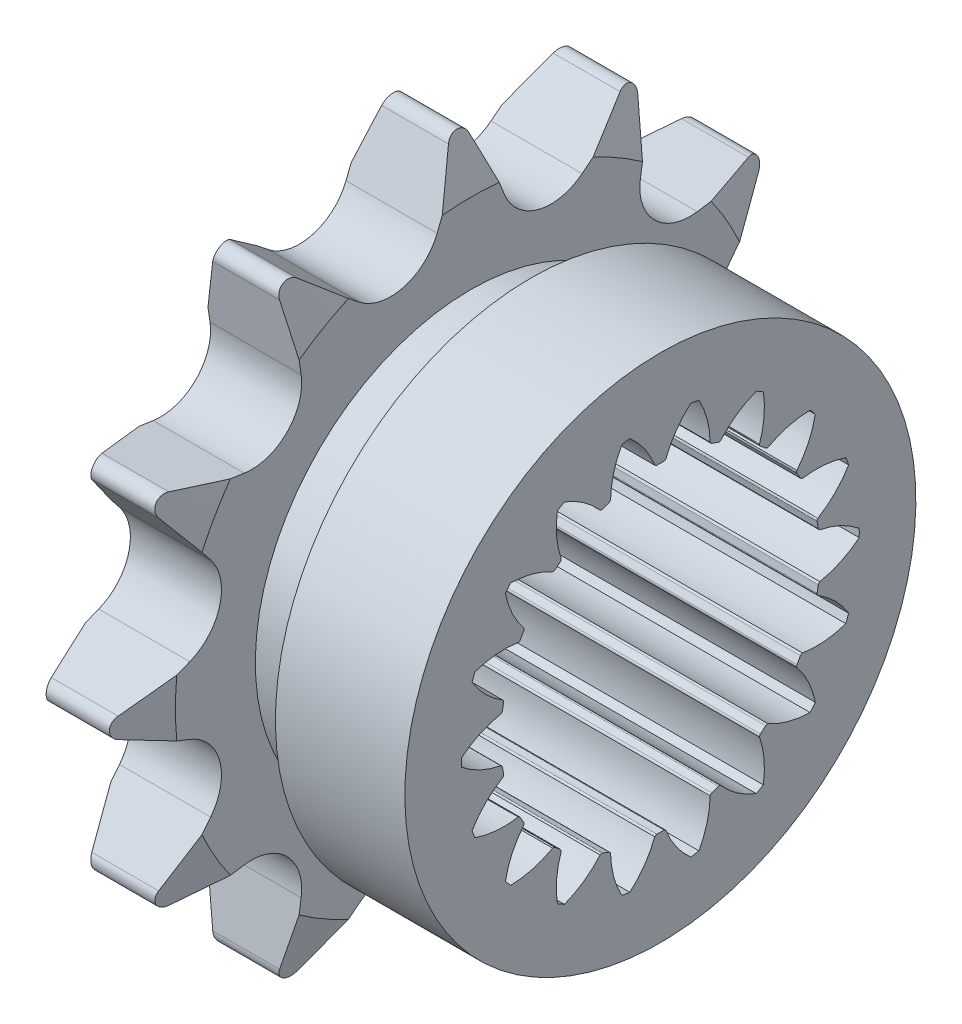
from build123d import *

# Parameters (mm, degrees)
SKETCH13_W         = 22.225
SKETCH13_H         = 27.5082
CUT_EXTRUDE1_DEPTH = 7.2136
CIRPATTERN1_COUNT  = 12
SKETCH15_W         = 127
SKETCH15_H         = 22.5171
SKETCH16_W         = 4.7625
SKETCH16_H         = 3.175
CUT_EXTRUDE2_DEPTH = 45.803490606


with BuildPart() as part:
    # Sketch13 → Revolve1 (revolve)
    with BuildSketch(Plane.XY):
        with Locations((11.1125, 13.7541)):
            Rectangle(SKETCH13_W, SKETCH13_H)
    revolve(axis=Axis((0, 0, 0), (-1, 0, 0)))

    # Sketch6 → Cut-Extrude1 (cut)
    with BuildSketch(Plane(origin=(0, -16.51, 0), x_dir=(0, 0, -1), z_dir=(1, 0, 0))):
        with BuildLine():
            Line((-0.805715716, 43.469749783), (-2.663822441, 38.756002806))
            ThreePointArc((-2.663822441, 38.756002806), (-5.324614334, 36.381731224), (-8.816063498, 37.107514783))
            Line((-8.816063498, 37.107514783), (-12.782104613, 40.260686049))
            ThreePointArc((-12.782104613, 40.260686049), (-13.256994885, 40.44645554), (-13.7541, 40.332800012))
            ThreePointArc((-13.7541, 40.332800012), (-7.119646056, 43.080880815), (0, 44.0182))
            ThreePointArc((0, 44.0182), (-0.487333422, 43.868076017), (-0.805715716, 43.469749783))
        make_face()
    cut_extrude1 = extrude(amount=CUT_EXTRUDE1_DEPTH, mode=Mode.SUBTRACT)

    # CirPattern1: Cut-Extrude1 ×12 about axis
    cirpattern1_axis = Axis((-63.015770793, 0, 0), (1, 0, 0))
    for i in range(1, CIRPATTERN1_COUNT):
        add(cut_extrude1.rotate(cirpattern1_axis, i * 360 / CIRPATTERN1_COUNT), mode=Mode.SUBTRACT)

    # Sketch15 → hub Cut-Revolve3 (revolve, cut)
    with BuildSketch(Plane.XY):
        with Locations((70.7136, 31.48965)):
            Rectangle(SKETCH15_W, SKETCH15_H)
        with Locations((-63.5, 31.48965)):
            Rectangle(SKETCH15_W, SKETCH15_H)
    revolve(axis=Axis((0, 0, 0), (-1, 0, 0)), mode=Mode.SUBTRACT)

    # Sketch4 → Teeth Chamfer (revolve, cut)
    with BuildSketch(Plane.XY):
        Polygon((0, 27.5082), (1.104501883, 27.5082), (0, 23.386142857), align=None)
        Polygon((7.2136, 27.5082), (6.109098117, 27.5082), (7.2136, 23.386142857), align=None)
    revolve(axis=Axis((0, 0, 0), (-1, 0, 0)), mode=Mode.SUBTRACT)

    # Sketch16 → Recess (revolve, cut)
    with BuildSketch(Plane.XY):
        with Locations((9.59485, 18.6436)):
            Rectangle(SKETCH16_W, SKETCH16_H)
    revolve(axis=Axis((0, 0, 0), (-1, 0, 0)), mode=Mode.SUBTRACT)

    # Sketch36 → Cut-Extrude2 (cut, through all)
    with BuildSketch(Plane.ZY):
        with BuildLine():
            ThreePointArc((-4.7729934, 11.8201419), (-6.061029895, 12.982143528), (-7.592553624, 13.796834183))
            ThreePointArc((-7.592553624, 13.796834183), (-7.873999984, 13.638168068), (-8.152132052, 13.473761428))
            ThreePointArc((-8.152132052, 13.473761428), (-8.212351117, 11.740077645), (-7.850046439, 10.043604504))
            ThreePointArc((-7.850046439, 10.043604504), (-7.86626214, 9.947703548), (-7.918307228, 9.865537551))
            ThreePointArc((-7.918307228, 9.865537551), (-8.13141367, 9.690641477), (-8.340658225, 9.511142985))
            ThreePointArc((-8.340658225, 9.511142985), (-8.430613472, 9.474156555), (-8.527873304, 9.474840233))
            ThreePointArc((-8.527873304, 9.474840233), (-10.135659657, 10.126230162), (-11.853461818, 10.367976993))
            ThreePointArc((-11.853461818, 10.367976993), (-12.063667879, 10.122619291), (-12.268796147, 9.873000815))
            ThreePointArc((-12.268796147, 9.873000815), (-11.732428783, 8.223274824), (-10.811745764, 6.753027031))
            ThreePointArc((-10.811745764, 6.753027031), (-10.794183479, 6.657363513), (-10.814987438, 6.562352263))
            ThreePointArc((-10.814987438, 6.562352263), (-10.95542401, 6.325117018), (-11.090657474, 6.084877757))
            ThreePointArc((-11.090657474, 6.084877757), (-11.162537651, 6.019355375), (-11.254165829, 5.986733001))
            ThreePointArc((-11.254165829, 5.986733001), (-12.987779277, 6.048943991), (-14.684667578, 5.688588763))
            ThreePointArc((-14.684667578, 5.688588763), (-14.798279386, 5.386133234), (-14.905662359, 5.081410594))
            ThreePointArc((-14.905662359, 5.081410594), (-13.837402385, 3.714623697), (-12.469388985, 2.647934833))
            ThreePointArc((-12.469388985, 2.647934833), (-12.420166986, 2.564047187), (-12.407220551, 2.467650443))
            ThreePointArc((-12.407220551, 2.467650443), (-12.458048528, 2.196690097), (-12.50295975, 1.924686467))
            ThreePointArc((-12.50295975, 1.924686467), (-12.548095048, 1.8385311), (-12.623039862, 1.776537414))
            ThreePointArc((-12.623039862, 1.776537414), (-14.273381038, 1.242065902), (-15.744685706, 0.323072774))
            ThreePointArc((-15.744685706, 0.323072774), (-15.748, 1.8e-08), (-15.744685707, -0.323072738))
            ThreePointArc((-15.744685707, -0.323072738), (-14.273381041, -1.24206587), (-12.623039866, -1.776537385))
            ThreePointArc((-12.623039866, -1.776537385), (-12.548095052, -1.838531072), (-12.502959755, -1.924686439))
            ThreePointArc((-12.502959755, -1.924686439), (-12.458048533, -2.196690069), (-12.407220557, -2.467650415))
            ThreePointArc((-12.407220557, -2.467650415), (-12.420166992, -2.564047159), (-12.469388991, -2.647934805))
            ThreePointArc((-12.469388991, -2.647934805), (-13.837402393, -3.714623666), (-14.905662371, -5.08141056))
            ThreePointArc((-14.905662371, -5.08141056), (-14.798279398, -5.3861332), (-14.684667591, -5.68858873))
            ThreePointArc((-14.684667591, -5.68858873), (-12.987779291, -6.048943962), (-11.254165843, -5.986732975))
            ThreePointArc((-11.254165843, -5.986732975), (-11.162537665, -6.01935535), (-11.090657488, -6.084877731))
            ThreePointArc((-11.090657488, -6.084877731), (-10.955424024, -6.325116993), (-10.814987453, -6.562352239))
            ThreePointArc((-10.814987453, -6.562352239), (-10.794183495, -6.657363489), (-10.811745779, -6.753027006))
            ThreePointArc((-10.811745779, -6.753027006), (-11.732428801, -8.223274797), (-12.26879617, -9.873000787))
            ThreePointArc((-12.26879617, -9.873000787), (-12.063667902, -10.122619264), (-11.853461841, -10.367976966))
            ThreePointArc((-11.853461841, -10.367976966), (-10.13565968, -10.126230139), (-8.527873325, -9.474840214))
            ThreePointArc((-8.527873325, -9.474840214), (-8.430613493, -9.474156536), (-8.340658247, -9.511142966))
            ThreePointArc((-8.340658247, -9.511142966), (-8.131413692, -9.690641459), (-7.91830725, -9.865537533))
            ThreePointArc((-7.91830725, -9.865537533), (-7.866262163, -9.94770353), (-7.850046462, -10.043604486))
            ThreePointArc((-7.850046462, -10.043604486), (-8.212351144, -11.740077626), (-8.152132082, -13.473761409))
            ThreePointArc((-8.152132082, -13.473761409), (-7.874000016, -13.63816805), (-7.592553655, -13.796834166))
            ThreePointArc((-7.592553655, -13.796834166), (-6.061029924, -12.982143514), (-4.772993427, -11.820141889))
            ThreePointArc((-4.772993427, -11.820141889), (-4.681832912, -11.78623462), (-4.584652527, -11.79022399))
            ThreePointArc((-4.584652527, -11.79022399), (-4.326634863, -11.887331546), (-4.066562331, -11.9787934))
            ThreePointArc((-4.066562331, -11.9787934), (-3.98955352, -12.038203713), (-3.941515687, -12.122775038))
            ThreePointArc((-3.941515687, -12.122775038), (-3.701742737, -13.840853828), (-3.052200553, -15.449387554))
            ThreePointArc((-3.052200553, -15.449387554), (-2.73461152, -15.508752491), (-2.415871444, -15.561589545))
            ThreePointArc((-2.415871444, -15.561589545), (-1.255350509, -14.272218786), (-0.442420079, -12.739760006))
            ThreePointArc((-0.442420079, -12.739760006), (-0.368354185, -12.676718863), (-0.27567005, -12.647229995))
            ThreePointArc((-0.27567005, -12.647229995), (-1.4e-08, -12.65023401), (0.275670021, -12.647229995))
            ThreePointArc((0.275670021, -12.647229995), (0.368354156, -12.676718864), (0.44242005, -12.739760007))
            ThreePointArc((0.44242005, -12.739760007), (1.255350476, -14.272218789), (2.415871408, -15.561589551))
            ThreePointArc((2.415871408, -15.561589551), (2.734611484, -15.508752498), (3.052200518, -15.449387561))
            ThreePointArc((3.052200518, -15.449387561), (3.701742705, -13.840853836), (3.941515659, -12.122775047))
            ThreePointArc((3.941515659, -12.122775047), (3.989553493, -12.038203723), (4.066562304, -11.978793409))
            ThreePointArc((4.066562304, -11.978793409), (4.326634836, -11.887331556), (4.5846525, -11.790224))
            ThreePointArc((4.5846525, -11.790224), (4.681832885, -11.786234631), (4.7729934, -11.8201419))
            ThreePointArc((4.7729934, -11.8201419), (6.061029895, -12.982143528), (7.592553624, -13.796834183))
            ThreePointArc((7.592553624, -13.796834183), (7.873999984, -13.638168068), (8.152132052, -13.473761428))
            ThreePointArc((8.152132052, -13.473761428), (8.212351117, -11.740077645), (7.850046439, -10.043604504))
            ThreePointArc((7.850046439, -10.043604504), (7.86626214, -9.947703548), (7.918307228, -9.865537551))
            ThreePointArc((7.918307228, -9.865537551), (8.13141367, -9.690641477), (8.340658225, -9.511142985))
            ThreePointArc((8.340658225, -9.511142985), (8.430613472, -9.474156555), (8.527873304, -9.474840233))
            ThreePointArc((8.527873304, -9.474840233), (10.135659657, -10.126230162), (11.853461818, -10.367976993))
            ThreePointArc((11.853461818, -10.367976993), (12.063667879, -10.122619291), (12.268796147, -9.873000815))
            ThreePointArc((12.268796147, -9.873000815), (11.732428783, -8.223274824), (10.811745764, -6.753027031))
            ThreePointArc((10.811745764, -6.753027031), (10.794183479, -6.657363513), (10.814987438, -6.562352263))
            ThreePointArc((10.814987438, -6.562352263), (10.95542401, -6.325117018), (11.090657474, -6.084877757))
            ThreePointArc((11.090657474, -6.084877757), (11.162537651, -6.019355375), (11.254165829, -5.986733001))
            ThreePointArc((11.254165829, -5.986733001), (12.987779277, -6.048943991), (14.684667578, -5.688588763))
            ThreePointArc((14.684667578, -5.688588763), (14.798279386, -5.386133234), (14.905662359, -5.081410594))
            ThreePointArc((14.905662359, -5.081410594), (13.837402385, -3.714623697), (12.469388985, -2.647934833))
            ThreePointArc((12.469388985, -2.647934833), (12.420166986, -2.564047187), (12.407220551, -2.467650443))
            ThreePointArc((12.407220551, -2.467650443), (12.458048528, -2.196690097), (12.50295975, -1.924686467))
            ThreePointArc((12.50295975, -1.924686467), (12.548095048, -1.8385311), (12.623039862, -1.776537414))
            ThreePointArc((12.623039862, -1.776537414), (14.273381038, -1.242065902), (15.744685706, -0.323072774))
            ThreePointArc((15.744685706, -0.323072774), (15.748, -1.8e-08), (15.744685707, 0.323072738))
            ThreePointArc((15.744685707, 0.323072738), (14.273381041, 1.24206587), (12.623039866, 1.776537385))
            ThreePointArc((12.623039866, 1.776537385), (12.548095052, 1.838531072), (12.502959755, 1.924686439))
            ThreePointArc((12.502959755, 1.924686439), (12.458048533, 2.196690069), (12.407220557, 2.467650415))
            ThreePointArc((12.407220557, 2.467650415), (12.420166992, 2.564047159), (12.469388991, 2.647934805))
            ThreePointArc((12.469388991, 2.647934805), (13.837402393, 3.714623666), (14.905662371, 5.08141056))
            ThreePointArc((14.905662371, 5.08141056), (14.798279398, 5.3861332), (14.684667591, 5.68858873))
            ThreePointArc((14.684667591, 5.68858873), (12.987779291, 6.048943962), (11.254165843, 5.986732975))
            ThreePointArc((11.254165843, 5.986732975), (11.162537665, 6.01935535), (11.090657488, 6.084877731))
            ThreePointArc((11.090657488, 6.084877731), (10.955424024, 6.325116993), (10.814987453, 6.562352239))
            ThreePointArc((10.814987453, 6.562352239), (10.794183495, 6.657363489), (10.811745779, 6.753027006))
            ThreePointArc((10.811745779, 6.753027006), (11.732428801, 8.223274797), (12.26879617, 9.873000787))
            ThreePointArc((12.26879617, 9.873000787), (12.063667902, 10.122619264), (11.853461841, 10.367976966))
            ThreePointArc((11.853461841, 10.367976966), (10.13565968, 10.126230139), (8.527873325, 9.474840214))
            ThreePointArc((8.527873325, 9.474840214), (8.430613493, 9.474156536), (8.340658247, 9.511142966))
            ThreePointArc((8.340658247, 9.511142966), (8.131413692, 9.690641459), (7.91830725, 9.865537533))
            ThreePointArc((7.91830725, 9.865537533), (7.866262163, 9.94770353), (7.850046462, 10.043604486))
            ThreePointArc((7.850046462, 10.043604486), (8.212351144, 11.740077626), (8.152132082, 13.473761409))
            ThreePointArc((8.152132082, 13.473761409), (7.874000016, 13.63816805), (7.592553655, 13.796834166))
            ThreePointArc((7.592553655, 13.796834166), (6.061029924, 12.982143514), (4.772993427, 11.820141889))
            ThreePointArc((4.772993427, 11.820141889), (4.681832912, 11.78623462), (4.584652527, 11.79022399))
            ThreePointArc((4.584652527, 11.79022399), (4.326634863, 11.887331546), (4.066562331, 11.9787934))
            ThreePointArc((4.066562331, 11.9787934), (3.98955352, 12.038203713), (3.941515687, 12.122775038))
            ThreePointArc((3.941515687, 12.122775038), (3.701742737, 13.840853828), (3.052200553, 15.449387554))
            ThreePointArc((3.052200553, 15.449387554), (2.73461152, 15.508752491), (2.415871444, 15.561589545))
            ThreePointArc((2.415871444, 15.561589545), (1.255350509, 14.272218786), (0.442420079, 12.739760006))
            ThreePointArc((0.442420079, 12.739760006), (0.368354185, 12.676718863), (0.27567005, 12.647229995))
            ThreePointArc((0.27567005, 12.647229995), (1.4e-08, 12.65023401), (-0.275670021, 12.647229995))
            ThreePointArc((-0.275670021, 12.647229995), (-0.368354156, 12.676718864), (-0.44242005, 12.739760007))
            ThreePointArc((-0.44242005, 12.739760007), (-1.255350476, 14.272218789), (-2.415871408, 15.561589551))
            ThreePointArc((-2.415871408, 15.561589551), (-2.734611484, 15.508752498), (-3.052200518, 15.449387561))
            ThreePointArc((-3.052200518, 15.449387561), (-3.701742705, 13.840853836), (-3.941515659, 12.122775047))
            ThreePointArc((-3.941515659, 12.122775047), (-3.989553493, 12.038203723), (-4.066562304, 11.978793409))
            ThreePointArc((-4.066562304, 11.978793409), (-4.326634836, 11.887331556), (-4.5846525, 11.790224))
            ThreePointArc((-4.5846525, 11.790224), (-4.681832885, 11.786234631), (-4.7729934, 11.8201419))
        make_face()
    extrude(amount=-CUT_EXTRUDE2_DEPTH, mode=Mode.SUBTRACT)


solid = part.part
